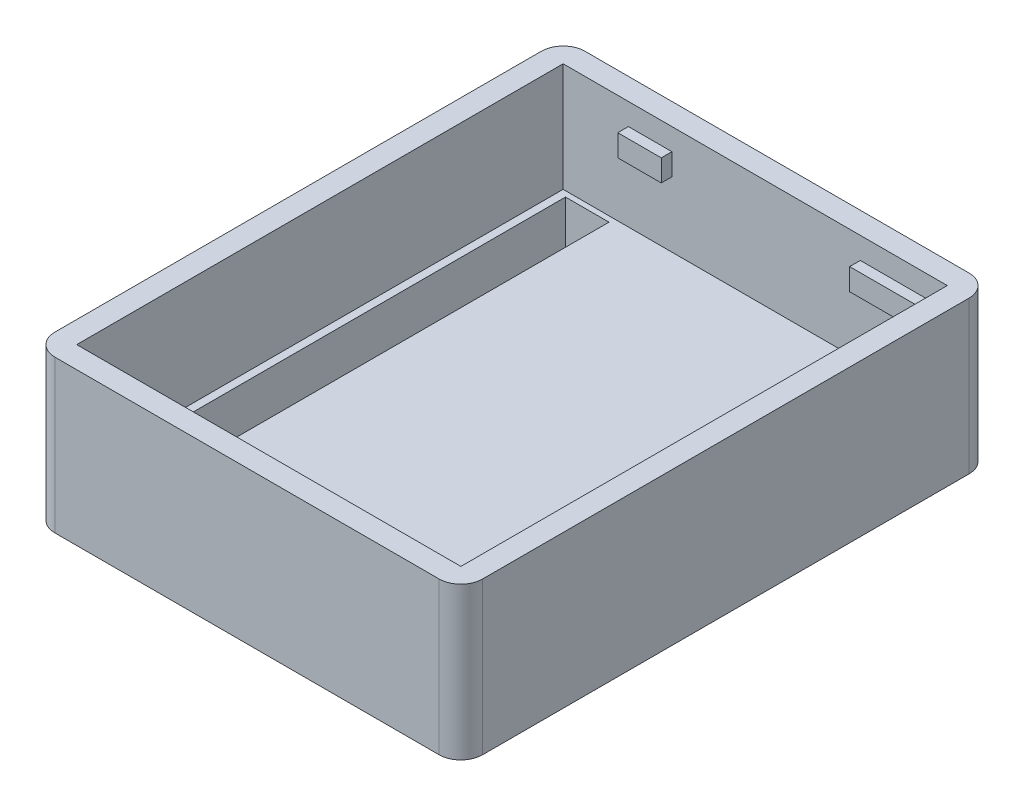
from build123d import *

# Parameters (mm, degrees)
BOSS_EXTRU_1_DEPTH      = 7
ESQUISSE2_W             = 17.66012
ESQUISSE2_H             = 22.36185
ENL_V_MAT_EXTRU_1_DEPTH = 5
ESQUISSE5_W             = 2
ESQUISSE5_H             = 21.86
ENL_V_MAT_EXTRU_3_DEPTH = 32.702051256
ESQUISSE6_W             = 3
ESQUISSE6_H             = 1
BOSS_EXTRU_2_DEPTH      = 0.48904
ESQUISSE7_W             = 3
ESQUISSE7_H             = 1
BOSS_EXTRU_3_DEPTH      = 0.48904
ESQUISSE8_W             = 3
ESQUISSE8_H             = 1
BOSS_EXTRU_4_DEPTH      = 0.48904
ESQUISSE9_W             = 3
ESQUISSE9_H             = 1
BOSS_EXTRU_5_DEPTH      = 0.48904
ESQUISSE10_W            = 2
ESQUISSE10_H            = 1
BOSS_EXTRU_6_DEPTH      = 0.48904
ESQUISSE11_W            = 2
ESQUISSE11_H            = 1
BOSS_EXTRU_7_DEPTH      = 0.48904


with BuildPart() as part:
    # Esquisse1 → Boss.-Extru.1 (new body)
    with BuildSketch(Plane(origin=(0, 0, 0), x_dir=(1, 0, 0), z_dir=(0, 1, 0))):
        with BuildLine():
            Line((1, 0), (18.66012, 0))
            ThreePointArc((18.66012, 0), (19.367226781, 0.292893219), (19.66012, 1))
            Line((19.66012, 1), (19.66012, 23.36185))
            ThreePointArc((19.66012, 23.36185), (19.367226781, 24.068956781), (18.66012, 24.36185))
            Line((18.66012, 24.36185), (1, 24.36185))
            ThreePointArc((1, 24.36185), (0.292893219, 24.068956781), (0, 23.36185))
            Line((0, 23.36185), (0, 1))
            ThreePointArc((0, 1), (0.292893219, 0.292893219), (1, 0))
        make_face()
    extrude(amount=BOSS_EXTRU_1_DEPTH)

    # Esquisse2 → Enlèv. mat.-Extru.1 (cut)
    with BuildSketch(Plane(origin=(0, 7, 0), x_dir=(1, 0, 0), z_dir=(0, 1, 0))):
        with Locations((9.83006, 12.180925)):
            Rectangle(ESQUISSE2_W, ESQUISSE2_H)
    extrude(amount=-ENL_V_MAT_EXTRU_1_DEPTH, mode=Mode.SUBTRACT)

    # Esquisse5 → Enlèv. mat.-Extru.3 (cut, through all)
    with BuildSketch(Plane(origin=(0, 2, 0), x_dir=(1, 0, 0), z_dir=(0, 1, 0))):
        with Locations((2.36, 12.18)):
            Rectangle(ESQUISSE5_W, ESQUISSE5_H)
    extrude(amount=-ENL_V_MAT_EXTRU_3_DEPTH, mode=Mode.SUBTRACT)

    # Esquisse6 → Boss.-Extru.2 (add)
    with BuildSketch(Plane.XY.offset(-23.36185)):
        with Locations((16.16012, 5.5)):
            Rectangle(ESQUISSE6_W, ESQUISSE6_H)
    extrude(amount=BOSS_EXTRU_2_DEPTH)

    # Esquisse7 → Boss.-Extru.3 (add)
    with BuildSketch(Plane.ZY.offset(-18.66012)):
        with Locations((-20.86185, 5.5)):
            Rectangle(ESQUISSE7_W, ESQUISSE7_H)
    extrude(amount=BOSS_EXTRU_3_DEPTH)

    # Esquisse8 → Boss.-Extru.4 (add)
    with BuildSketch(Plane(origin=(0, 0, -1), x_dir=(-1, 0, 0), z_dir=(0, 0, -1))):
        with Locations((-16.16012, 5.5)):
            Rectangle(ESQUISSE8_W, ESQUISSE8_H)
    extrude(amount=BOSS_EXTRU_4_DEPTH)

    # Esquisse9 → Boss.-Extru.5 (add)
    with BuildSketch(Plane.ZY.offset(-18.66012)):
        with Locations((-3.5, 5.5)):
            Rectangle(ESQUISSE9_W, ESQUISSE9_H)
    extrude(amount=BOSS_EXTRU_5_DEPTH)

    # Esquisse10 → Boss.-Extru.6 (add)
    with BuildSketch(Plane.XY.offset(-23.36185)):
        with Locations((5, 5.5)):
            Rectangle(ESQUISSE10_W, ESQUISSE10_H)
    extrude(amount=BOSS_EXTRU_6_DEPTH)

    # Esquisse11 → Boss.-Extru.7 (add)
    with BuildSketch(Plane(origin=(0, 0, -1), x_dir=(-1, 0, 0), z_dir=(0, 0, -1))):
        with Locations((-5, 5.5)):
            Rectangle(ESQUISSE11_W, ESQUISSE11_H)
    extrude(amount=BOSS_EXTRU_7_DEPTH)


solid = part.part
